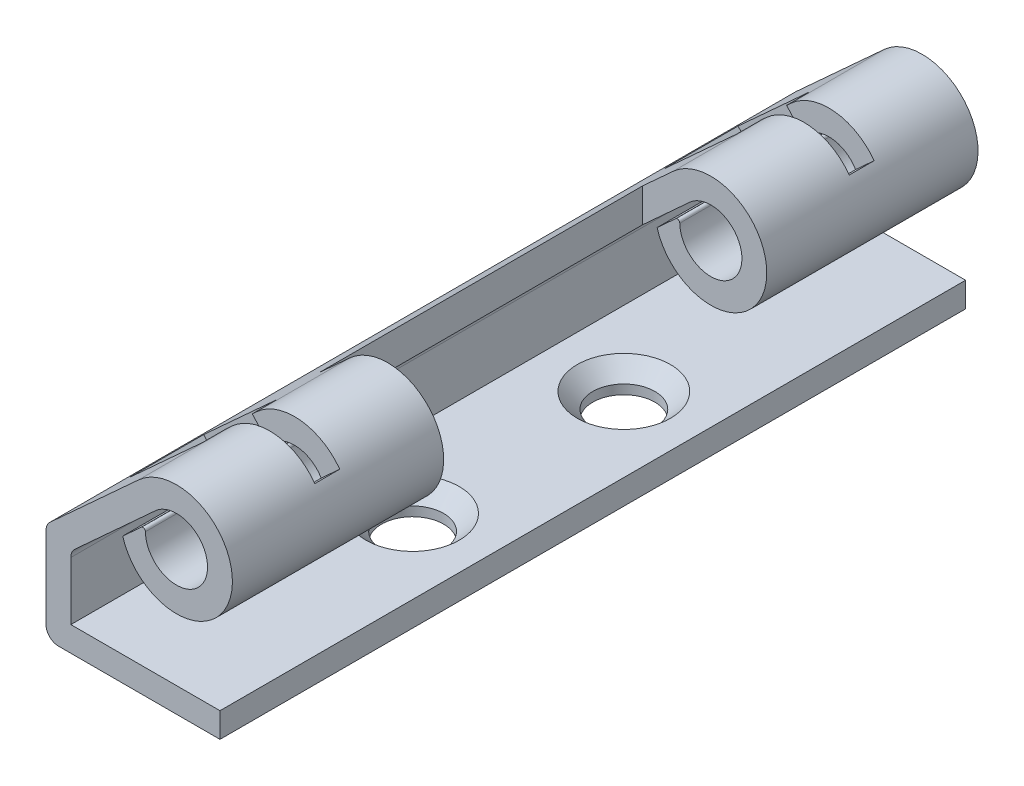
from build123d import *

# Parameters (mm, degrees)
EXTRUDE_1_DEPTH          = 30
CUT_EXTRUDE_1_REACH      = 37.944
SKETCH_2_W               = 10
SKETCH_2_H               = 26
HOLE_WIZARD_1_AT_2_COUNT = 2
HOLE_WIZARD_1_AT_2_PITCH = 17
CUT_EXTRUDE_2_DEPTH      = 5


with BuildPart() as part:
    # 草图1 → 凸台-拉伸1 (new, symmetric)
    with BuildSketch(Plane.XY):
        with BuildLine():
            Line((0, 0), (-13, 0))
            ThreePointArc((-13, 0), (-13.707106781, 0.292893219), (-14, 1))
            Line((-14, 1), (-14, 7.559208386))
            ThreePointArc((-14, 7.559208386), (-13.915047807, 7.962553786), (-13.674624977, 8.297369033))
            Line((-13.674624977, 8.297369033), (-6.535812398, 14.821722909))
            ThreePointArc((-6.535812398, 14.821722909), (0.830646134, 10.277091966), (-7.82487065, 10.256821067))
            Line((-7.82487065, 10.256821067), (-6.3347696, 11.618664715))
            ThreePointArc((-6.3347696, 11.618664715), (-6.120158424, 11.654472256), (-5.999856115, 11.47317832))
            ThreePointArc((-5.999856115, 11.47317832), (-1.20700412, 10.503922746), (-5.186562443, 13.345401616))
            Line((-5.186562443, 13.345401616), (-11.674624977, 7.415785805))
            ThreePointArc((-11.674624977, 7.415785805), (-11.915047807, 7.080970558), (-12, 6.677625158))
            Line((-12, 6.677625158), (-12, 2))
            Line((-12, 2), (0, 2))
            Line((0, 2), (0, 0))
        make_face()
    extrude(amount=EXTRUDE_1_DEPTH, both=True)

    # 草图2 → 切除-拉伸1 (cut, up to next)
    with BuildSketch(Plane(origin=(0, 2, 0), x_dir=(1, 0, 0), z_dir=(0, 1, 0)), mode=Mode.PRIVATE) as cut_extrude_1_sk1:
        with Locations((-4, 0)):
            Rectangle(SKETCH_2_W, SKETCH_2_H)
    cut_extrude_1_tool1 = extrude(cut_extrude_1_sk1.sketch, amount=CUT_EXTRUDE_1_REACH, mode=Mode.PRIVATE) & part.part
    add(cut_extrude_1_tool1.solids().sort_by_distance((-4, 2, 0))[0], mode=Mode.SUBTRACT)

    # 草图3 → 打孔尺寸(%根据十字)槽沉头木螺钉的类型1 (revolve, cut)
    with BuildSketch(Plane(origin=(-6, 2, -8.5), x_dir=(0, 0, 1), z_dir=(1, 0, 0))):
        Polygon((0, 0), (0, 2), (2.5, 2), (2.5, 1.25), (3.75, 0), align=None)
    hole_wizard_1 = revolve(axis=Axis((-6, 8.35, -8.5), (0, -1, 0)), mode=Mode.SUBTRACT)

    # 打孔尺寸(%根据十字)槽沉头木螺钉的类型1 at 2: 打孔尺寸(%根据十字)槽沉头木螺钉的类型1 ×2
    with Locations(*[(0, 0, i * HOLE_WIZARD_1_AT_2_PITCH) for i in range(1, HOLE_WIZARD_1_AT_2_COUNT)]):
        add(hole_wizard_1, mode=Mode.SUBTRACT)

    # 草图5 → 切除-拉伸2 (cut)
    with BuildSketch(Plane(origin=(-10.355516916, 11.330791651, 0), x_dir=(0.7381606464067151, 0.6746249773736669, 0), z_dir=(-0.6746249773736669, 0.7381606464067151, 0))):
        Polygon((-3.325375023, 24.5), (4.674624977, 24.5), (4.674624977, 22.5), (9.674624977, 22.5), (9.674624977, 20.5), (4.674624977, 20.5), (4.674624977, 18.5), (-3.325375023, 18.5), align=None)
        Polygon((9.674624977, -22.5), (9.674624977, -20.5), (4.674624977, -20.5), (4.674624977, -18.5), (-3.325375023, -18.5), (-3.325375023, -24.5), (4.674624977, -24.5), (4.674624977, -22.5), align=None)
    extrude(amount=-CUT_EXTRUDE_2_DEPTH, mode=Mode.SUBTRACT)


solid = part.part
